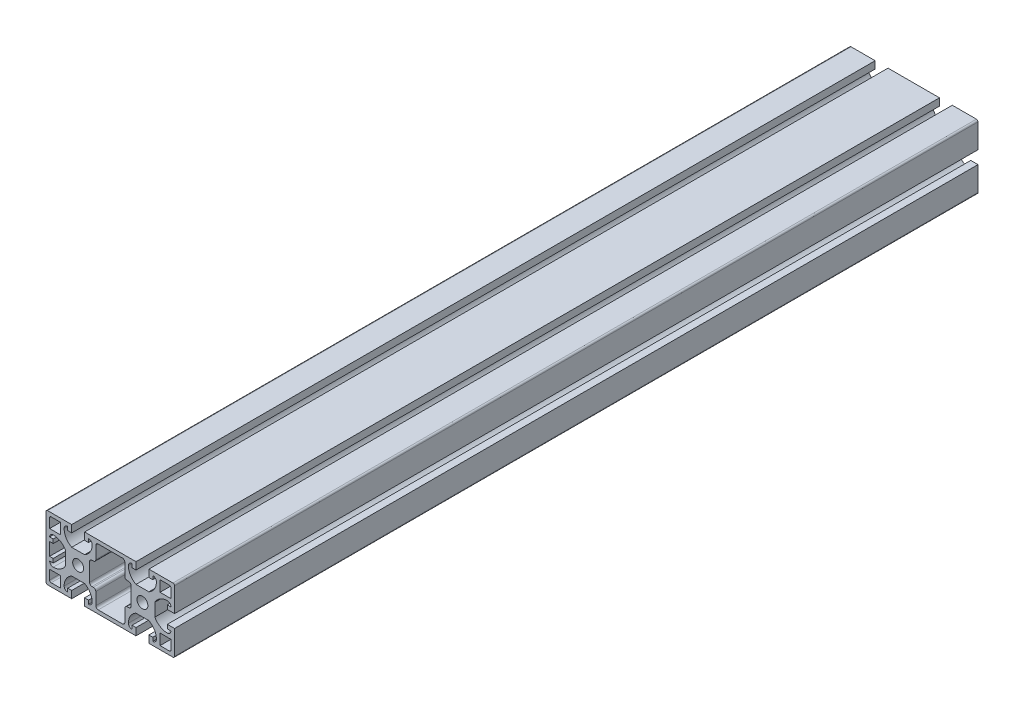
from build123d import *

# Parameters (mm, degrees)
SZKIC1_R                    = 3.4
DODANIE_WYCI_GNI_CIE1_DEPTH = 500


with BuildPart() as part:
    # Szkic1 → Dodanie-wyciągnięcie1 (new body)
    with BuildSketch(Plane.XY):
        with BuildLine():
            Line((-40, -19), (-40, 19))
            ThreePointArc((-40, 19), (-39.707106781, 19.707106781), (-39, 20))
            Line((-39, 20), (-24, 20))
            Line((-24, 20), (-24, 15.5))
            Line((-24, 15.5), (-26.471381771, 15.5))
            Line((-26.471381771, 15.5), (-26.471381771, 17.75))
            ThreePointArc((-26.471381771, 17.75), (-28.062372029, 17.090990258), (-28.721381771, 15.5))
            ThreePointArc((-28.721381771, 15.5), (-27.448087912, 10.962546258), (-24, 7.75))
            Line((-24, 7.75), (-16, 7.75))
            ThreePointArc((-16, 7.75), (-12.551912088, 10.962546258), (-11.278618229, 15.5))
            ThreePointArc((-11.278618229, 15.5), (-11.937627971, 17.090990258), (-13.528618229, 17.75))
            Line((-13.528618229, 17.75), (-13.528618229, 15.5))
            Line((-13.528618229, 15.5), (-16, 15.5))
            Line((-16, 15.5), (-16, 20))
            Line((-16, 20), (13.528618229, 20))
            Line((13.528618229, 20), (16, 20))
            Line((16, 20), (16, 15.5))
            Line((16, 15.5), (13.528618229, 15.5))
            Line((13.528618229, 15.5), (13.528618229, 17.75))
            ThreePointArc((13.528618229, 17.75), (11.937627971, 17.090990258), (11.278618229, 15.5))
            ThreePointArc((11.278618229, 15.5), (12.551912088, 10.962546258), (16, 7.75))
            Line((16, 7.75), (24, 7.75))
            ThreePointArc((24, 7.75), (27.448087912, 10.962546258), (28.721381771, 15.5))
            ThreePointArc((28.721381771, 15.5), (28.062372029, 17.090990258), (26.471381771, 17.75))
            Line((26.471381771, 17.75), (26.471381771, 15.5))
            Line((26.471381771, 15.5), (24, 15.5))
            Line((24, 15.5), (24, 20))
            Line((24, 20), (39, 20))
            ThreePointArc((39, 20), (39.707106781, 19.707106781), (40, 19))
            Line((40, 19), (40, 4))
            Line((40, 4), (35.5, 4))
            Line((35.5, 4), (35.5, 6.471381771))
            Line((35.5, 6.471381771), (37.75, 6.471381771))
            ThreePointArc((37.75, 6.471381771), (37.090990258, 8.062372029), (35.5, 8.721381771))
            ThreePointArc((35.5, 8.721381771), (30.962546258, 7.448087912), (27.75, 4))
            Line((27.75, 4), (27.75, -4))
            ThreePointArc((27.75, -4), (30.962546258, -7.448087912), (35.5, -8.721381771))
            ThreePointArc((35.5, -8.721381771), (37.090990258, -8.062372029), (37.75, -6.471381771))
            Line((37.75, -6.471381771), (35.5, -6.471381771))
            Line((35.5, -6.471381771), (35.5, -4))
            Line((35.5, -4), (40, -4))
            Line((40, -4), (40, -19))
            ThreePointArc((40, -19), (39.707106781, -19.707106781), (39, -20))
            Line((39, -20), (24, -20))
            Line((24, -20), (24, -15.5))
            Line((24, -15.5), (26.471381771, -15.5))
            Line((26.471381771, -15.5), (26.471381771, -17.75))
            ThreePointArc((26.471381771, -17.75), (28.062372029, -17.090990258), (28.721381771, -15.5))
            ThreePointArc((28.721381771, -15.5), (27.448087912, -10.962546258), (24, -7.75))
            Line((24, -7.75), (16, -7.75))
            ThreePointArc((16, -7.75), (12.551912088, -10.962546258), (11.278618229, -15.5))
            ThreePointArc((11.278618229, -15.5), (11.937627971, -17.090990258), (13.528618229, -17.75))
            Line((13.528618229, -17.75), (13.528618229, -15.5))
            Line((13.528618229, -15.5), (16, -15.5))
            Line((16, -15.5), (16, -20))
            Line((16, -20), (-16, -20))
            Line((-16, -20), (-16, -15.5))
            Line((-16, -15.5), (-13.528618229, -15.5))
            Line((-13.528618229, -15.5), (-13.528618229, -17.75))
            ThreePointArc((-13.528618229, -17.75), (-11.937627971, -17.090990258), (-11.278618229, -15.5))
            ThreePointArc((-11.278618229, -15.5), (-12.551912088, -10.962546258), (-16, -7.75))
            Line((-16, -7.75), (-24, -7.75))
            ThreePointArc((-24, -7.75), (-27.448087912, -10.962546258), (-28.721381771, -15.5))
            ThreePointArc((-28.721381771, -15.5), (-28.062372029, -17.090990258), (-26.471381771, -17.75))
            Line((-26.471381771, -17.75), (-26.471381771, -15.5))
            Line((-26.471381771, -15.5), (-24, -15.5))
            Line((-24, -15.5), (-24, -20))
            Line((-24, -20), (-39, -20))
            ThreePointArc((-39, -20), (-39.707106781, -19.707106781), (-40, -19))
        make_face()
        with Locations((-20, 0)):
            Circle(SZKIC1_R, mode=Mode.SUBTRACT)
        with Locations((20, 0)):
            Circle(SZKIC1_R, mode=Mode.SUBTRACT)
        with BuildLine():
            Line((30.971381771, -17.75), (36.75, -17.75))
            ThreePointArc((36.75, -17.75), (37.457106781, -17.457106781), (37.75, -16.75))
            Line((37.75, -16.75), (37.75, -10.971381771))
            Line((37.75, -10.971381771), (30.971381771, -10.971381771))
            Line((30.971381771, -10.971381771), (30.971381771, -17.75))
        make_face(mode=Mode.SUBTRACT)
        with BuildLine():
            Line((-35.5, -6.471381771), (-37.75, -6.471381771))
            ThreePointArc((-37.75, -6.471381771), (-37.090990258, -8.062372029), (-35.5, -8.721381771))
            ThreePointArc((-35.5, -8.721381771), (-30.962546258, -7.448087912), (-27.75, -4))
            Line((-27.75, -4), (-27.75, 4))
            ThreePointArc((-27.75, 4), (-30.962546258, 7.448087912), (-35.5, 8.721381771))
            ThreePointArc((-35.5, 8.721381771), (-37.090990258, 8.062372029), (-37.75, 6.471381771))
            Line((-37.75, 6.471381771), (-35.5, 6.471381771))
            Line((-35.5, 6.471381771), (-35.5, 4))
            Line((-35.5, 4), (-37.75, 4))
            Line((-37.75, 4), (-37.75, -4))
            Line((-37.75, -4), (-35.5, -4))
            Line((-35.5, -4), (-35.5, -6.471381771))
        make_face(mode=Mode.SUBTRACT)
        with BuildLine():
            Line((10.528618229, 7.090188806), (11.40950808, 7.090188806))
            ThreePointArc((11.40950808, 7.090188806), (12.470168251, 6.650848977), (12.90950808, 5.590188806))
            Line((12.90950808, 5.590188806), (12.90950808, -5.590188806))
            ThreePointArc((12.90950808, -5.590188806), (12.470168251, -6.650848977), (11.40950808, -7.090188806))
            Line((11.40950808, -7.090188806), (10.528618229, -7.090188806))
            ThreePointArc((10.528618229, -7.090188806), (9.467958057, -7.529528634), (9.028618229, -8.590188806))
            Line((9.028618229, -8.590188806), (9.028618229, -16.25))
            ThreePointArc((9.028618229, -16.25), (8.589278401, -17.310660172), (7.528618229, -17.75))
            Line((7.528618229, -17.75), (-7.528618229, -17.75))
            ThreePointArc((-7.528618229, -17.75), (-8.589278401, -17.310660172), (-9.028618229, -16.25))
            Line((-9.028618229, -16.25), (-9.028618229, -8.590188806))
            ThreePointArc((-9.028618229, -8.590188806), (-9.467958057, -7.529528634), (-10.528618229, -7.090188806))
            Line((-10.528618229, -7.090188806), (-11.40950808, -7.090188806))
            ThreePointArc((-11.40950808, -7.090188806), (-12.470168251, -6.650848977), (-12.90950808, -5.590188806))
            Line((-12.90950808, -5.590188806), (-12.90950808, 5.590188806))
            ThreePointArc((-12.90950808, 5.590188806), (-12.470168251, 6.650848977), (-11.40950808, 7.090188806))
            Line((-11.40950808, 7.090188806), (-10.528618229, 7.090188806))
            ThreePointArc((-10.528618229, 7.090188806), (-9.467958057, 7.529528634), (-9.028618229, 8.590188806))
            Line((-9.028618229, 8.590188806), (-9.028618229, 16.25))
            ThreePointArc((-9.028618229, 16.25), (-8.589278401, 17.310660172), (-7.528618229, 17.75))
            Line((-7.528618229, 17.75), (7.528618229, 17.75))
            ThreePointArc((7.528618229, 17.75), (8.589278401, 17.310660172), (9.028618229, 16.25))
            Line((9.028618229, 16.25), (9.028618229, 8.590188806))
            ThreePointArc((9.028618229, 8.590188806), (9.467958057, 7.529528634), (10.528618229, 7.090188806))
        make_face(mode=Mode.SUBTRACT)
        with BuildLine():
            Line((30.971381771, 10.971381771), (37.75, 10.971381771))
            Line((37.75, 10.971381771), (37.75, 16.75))
            ThreePointArc((37.75, 16.75), (37.457106781, 17.457106781), (36.75, 17.75))
            Line((36.75, 17.75), (30.971381771, 17.75))
            Line((30.971381771, 17.75), (30.971381771, 10.971381771))
        make_face(mode=Mode.SUBTRACT)
        with BuildLine():
            Line((-30.971381771, -10.971381771), (-30.971381771, -17.75))
            Line((-30.971381771, -17.75), (-36.75, -17.75))
            ThreePointArc((-36.75, -17.75), (-37.457106781, -17.457106781), (-37.75, -16.75))
            Line((-37.75, -16.75), (-37.75, -10.971381771))
            Line((-37.75, -10.971381771), (-30.971381771, -10.971381771))
        make_face(mode=Mode.SUBTRACT)
        with BuildLine():
            Line((-30.971381771, 17.75), (-36.75, 17.75))
            ThreePointArc((-36.75, 17.75), (-37.457106781, 17.457106781), (-37.75, 16.75))
            Line((-37.75, 16.75), (-37.75, 10.971381771))
            Line((-37.75, 10.971381771), (-30.971381771, 10.971381771))
            Line((-30.971381771, 10.971381771), (-30.971381771, 17.75))
        make_face(mode=Mode.SUBTRACT)
    extrude(amount=DODANIE_WYCI_GNI_CIE1_DEPTH)


solid = part.part
